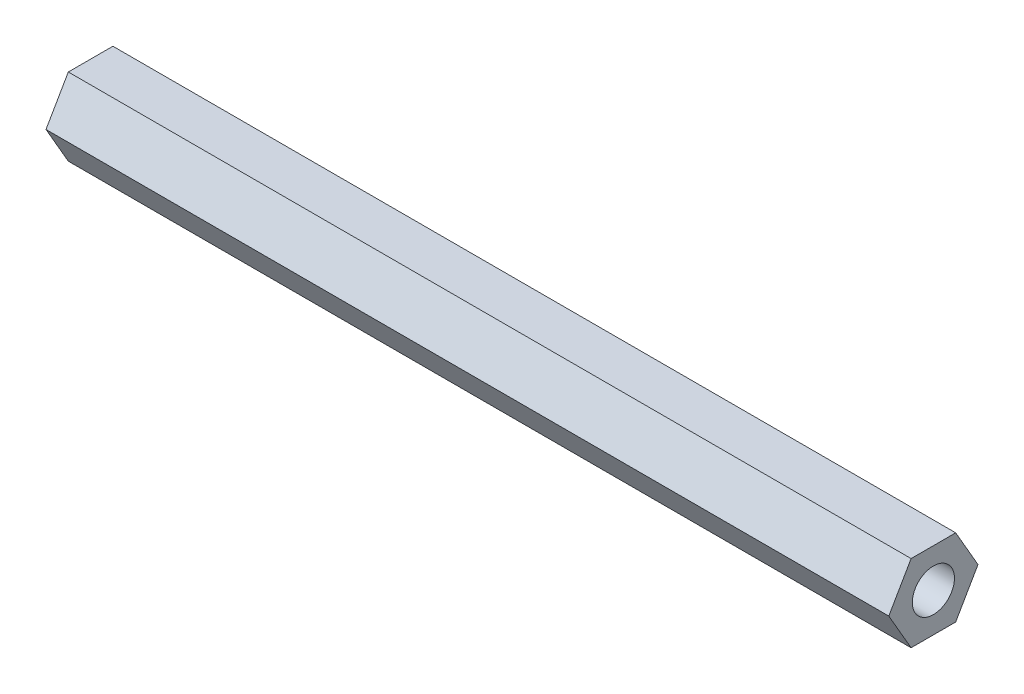
from build123d import *

# Parameters (mm, degrees)
HEX_2_DEPTH   = 60
BORE_SKETCH_W = 62
BORE_SKETCH_H = 1.5


with BuildPart() as part:
    # Hex Sketch → Hex 2 (new body)
    with BuildSketch(Plane(origin=(0, 0, 0), x_dir=(0, 0, -1), z_dir=(1, 0, 0))):
        Polygon((3.175426481, 0), (1.58771324, 2.75), (-1.58771324, 2.75), (-3.175426481, 0), (-1.58771324, -2.75), (1.58771324, -2.75), align=None)
    extrude(amount=HEX_2_DEPTH)

    # Bore Sketch → Bore (revolve, cut)
    with BuildSketch(Plane.XY):
        with Locations((30, 0.75)):
            Rectangle(BORE_SKETCH_W, BORE_SKETCH_H)
    revolve(axis=Axis((-400, 0, 0), (1, 0, 0)), mode=Mode.SUBTRACT)


solid = part.part
